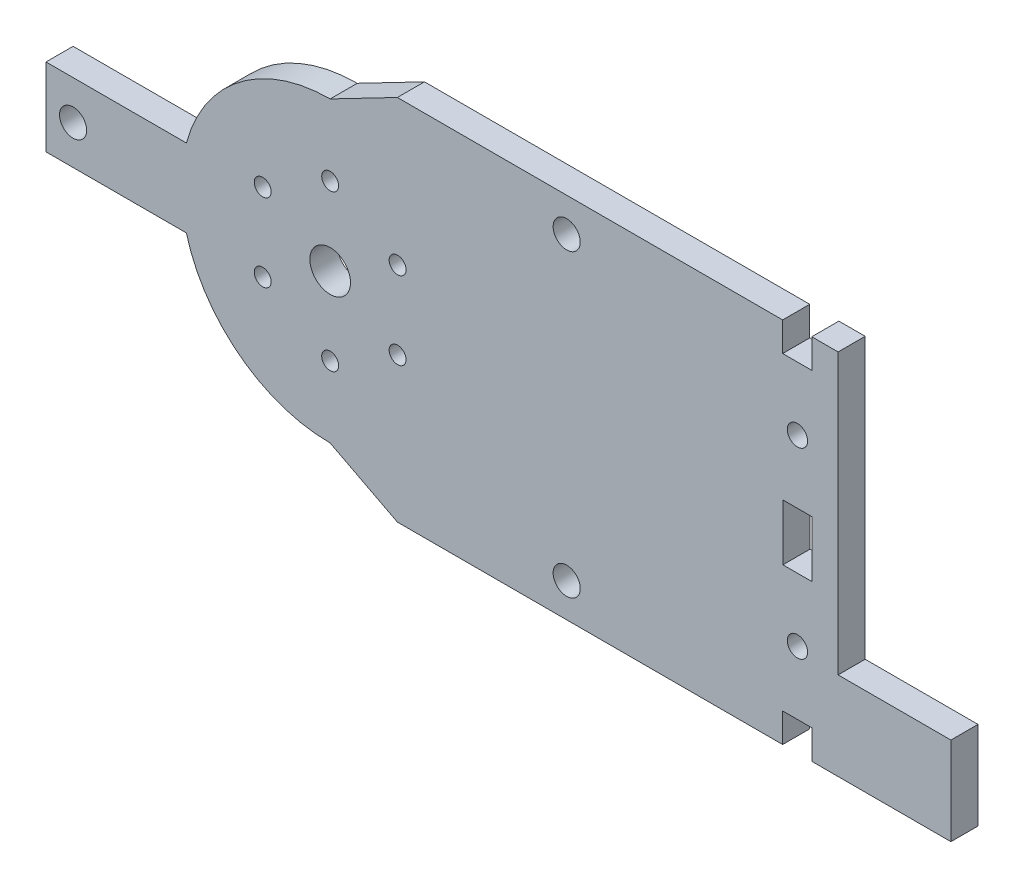
from build123d import *

# Parameters (mm, degrees)
SKETCH_1_R      = 1.5
SKETCH_1_R_2    = 3
SKETCH_1_R_3    = 1.25
SKETCH_1_R_4    = 2
SKETCH_1_W      = 4.3
SKETCH_1_H      = 8.3
EXTRUDE_1_DEPTH = 4


with BuildPart() as part:
    # 草图1 → 凸台-拉伸1 (new body)
    with BuildSketch(Plane.XY):
        with BuildLine():
            Line((32.115707856, 27.15), (32.115707856, 22.85))
            Line((32.115707856, 22.85), (27.815707856, 22.85))
            Line((27.815707856, 22.85), (27.815707856, 27.15))
            Line((27.815707856, 27.15), (-29.075, 27.15))
            Line((-29.075, 27.15), (-38.998995168, 22.002009663))
            ThreePointArc((-38.998995168, 22.002009663), (-52.370174504, 17.472835843), (-60.236366221, 5.75))
            Line((-60.236366221, 5.75), (-80.958287312, 5.75))
            Line((-80.958287312, 5.75), (-80.958287312, -5.75))
            Line((-80.958287312, -5.75), (-60.236366221, -5.75))
            ThreePointArc((-60.236366221, -5.75), (-52.370174504, -17.472835843), (-38.998995168, -22.002009663))
            Line((-38.998995168, -22.002009663), (-29.075, -27.15))
            Line((-29.075, -27.15), (27.815707856, -27.15))
            Line((27.815707856, -27.15), (27.815707856, -22.85))
            Line((27.815707856, -22.85), (32.115707856, -22.85))
            Line((32.115707856, -22.85), (32.115707856, -27.15))
            Line((32.115707856, -27.15), (36.001004832, -27.15))
            Line((36.001004832, -27.15), (52.659242152, -27.15))
            Line((52.659242152, -27.15), (52.659242152, -14.15))
            Line((52.659242152, -14.15), (36.001004832, -14.15))
            Line((36.001004832, -14.15), (36.001004832, 27.15))
            Line((36.001004832, 27.15), (32.115707856, 27.15))
        make_face()
        with Locations((30.001004832, 13.5)):
            Circle(SKETCH_1_R, mode=Mode.SUBTRACT)
        with Locations(Location((30.001004832, -13.5, 0), (0, 0, 180))):
            Circle(SKETCH_1_R, mode=Mode.SUBTRACT)
        with Locations((-38.998995168, 0)):
            Circle(SKETCH_1_R_2, mode=Mode.SUBTRACT)
        with Locations((-38.998995168, -11.5)):
            Circle(SKETCH_1_R_3, mode=Mode.SUBTRACT)
        with Locations((-48.958287312, -5.75)):
            Circle(SKETCH_1_R_3, mode=Mode.SUBTRACT)
        with Locations((-48.958287312, 5.75)):
            Circle(SKETCH_1_R_3, mode=Mode.SUBTRACT)
        with Locations((-38.998995168, 11.5)):
            Circle(SKETCH_1_R_3, mode=Mode.SUBTRACT)
        with Locations((-29.039703025, 5.75)):
            Circle(SKETCH_1_R_3, mode=Mode.SUBTRACT)
        with Locations((-29.039703025, -5.75)):
            Circle(SKETCH_1_R_3, mode=Mode.SUBTRACT)
        with Locations((-4.075, -22.15)):
            Circle(SKETCH_1_R_4, mode=Mode.SUBTRACT)
        with Locations((-4.075, 22.15)):
            Circle(SKETCH_1_R_4, mode=Mode.SUBTRACT)
        with Locations((-76.958287312, 0)):
            Circle(SKETCH_1_R_4, mode=Mode.SUBTRACT)
        with Locations((30.001004832, 0)):
            Rectangle(SKETCH_1_W, SKETCH_1_H, mode=Mode.SUBTRACT)
    extrude(amount=EXTRUDE_1_DEPTH)


solid = part.part
